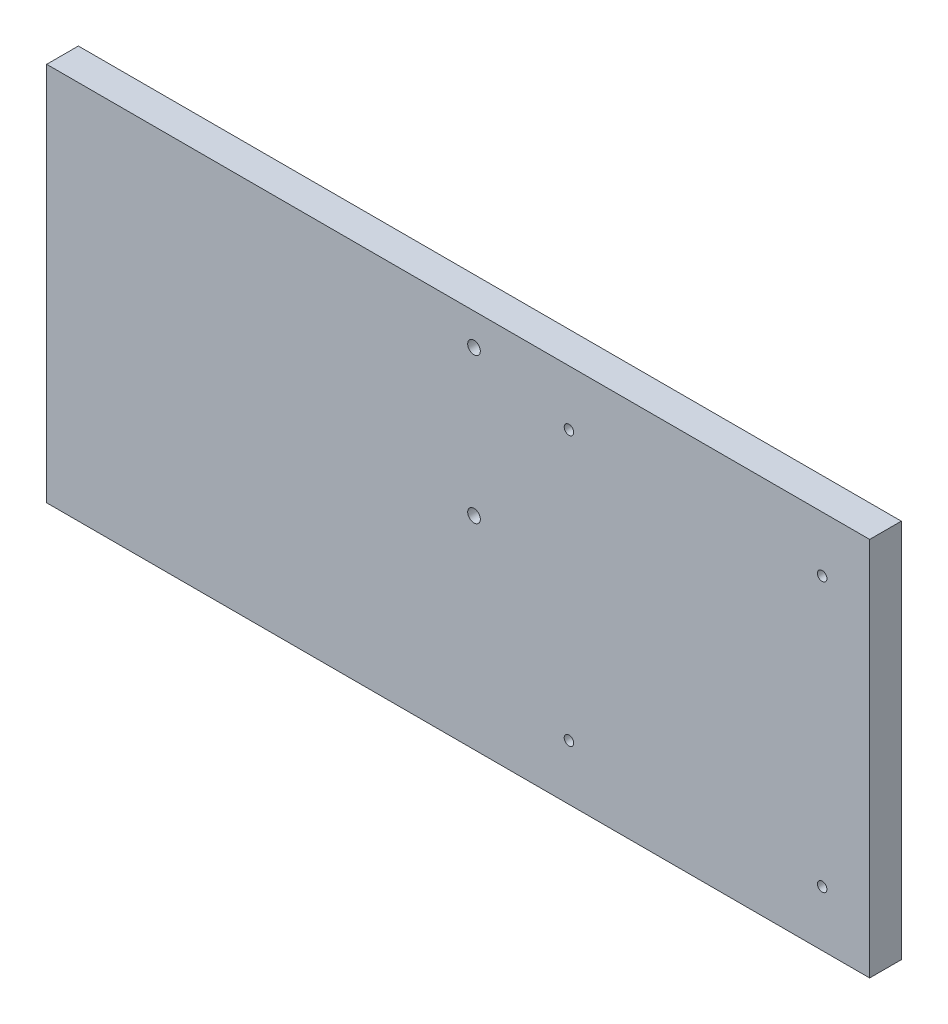
from build123d import *

# Parameters (mm, degrees)
ESBO_O1_W                = 260
ESBO_O1_H                = 120
ESBO_O1_R                = 1.5
ESBO_O1_R_2              = 2
RESSALTO_EXTRUS_O1_DEPTH = 10


with BuildPart() as part:
    # Esboço1 → Ressalto-extrusão1 (new body)
    with BuildSketch(Plane.XY):
        Rectangle(ESBO_O1_W, ESBO_O1_H)
        with Locations((115, 42.5)):
            Circle(ESBO_O1_R, mode=Mode.SUBTRACT)
        with Locations((115, -42.5)):
            Circle(ESBO_O1_R, mode=Mode.SUBTRACT)
        with Locations((35, -42.5)):
            Circle(ESBO_O1_R, mode=Mode.SUBTRACT)
        with Locations((35, 42.5)):
            Circle(ESBO_O1_R, mode=Mode.SUBTRACT)
        with Locations((5, 50)):
            Circle(ESBO_O1_R_2, mode=Mode.SUBTRACT)
        with Locations((5, 4)):
            Circle(ESBO_O1_R_2, mode=Mode.SUBTRACT)
    extrude(amount=RESSALTO_EXTRUS_O1_DEPTH)


solid = part.part
